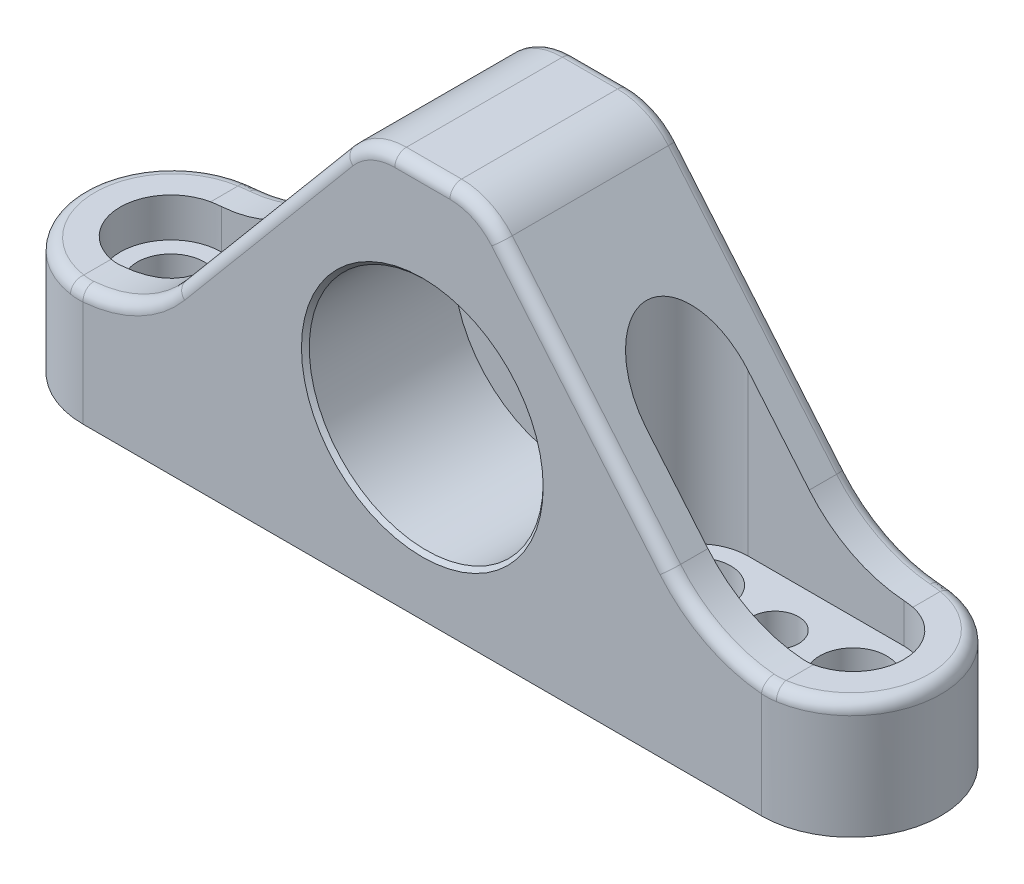
from build123d import *

# Parameters (mm, degrees)
BOSS_EXTRUDE1_DEPTH = 23
SKETCH2_OUTSIDE_W   = 271.2
SKETCH2_OUTSIDE_H   = 97.2
CUT_EXTRUDE1_DEPTH  = 151.429385427
FILLET1_R           = 35
FILLET2_R           = 17
CUT_EXTRUDE2_START  = 20
CUT_EXTRUDE2_DEPTH  = 131.429385516
SKETCH4_R           = 8.6
SKETCH4_R_2         = 6
CUT_EXTRUDE3_DEPTH  = 138.945641564
SKETCH5_R           = 30
CUT_EXTRUDE4_DEPTH  = 38
SKETCH6_R           = 4.5
SKETCH6_R_2         = 3.4
CUT_EXTRUDE5_DEPTH  = 156.614909412
CHAMFER1_SIZE       = 1
FILLET3_R           = 3


with BuildPart() as part:
    # Sketch1 → Boss-Extrude1 (new, symmetric)
    with BuildSketch(Plane.XY):
        Polygon((110, 0), (-110, 0), (-110, 30), (-73.736974182, 30), (-15, 100), (15, 100), (73.736974182, 30), (110, 30), align=None)
    extrude(amount=BOSS_EXTRUDE1_DEPTH, both=True)

    # Sketch2 outside → Cut-Extrude1 (cut, through all)
    with BuildSketch(Plane(origin=(0, 0, 0), x_dir=(1, 0, 0), z_dir=(0, 1, 0))):
        Rectangle(SKETCH2_OUTSIDE_W, SKETCH2_OUTSIDE_H)
        with BuildLine():
            Line((87, -23), (-87, -23))
            ThreePointArc((-87, -23), (-110, 0), (-87, 23))
            Line((-87, 23), (87, 23))
            ThreePointArc((87, 23), (110, 0), (87, -23))
        make_face(mode=Mode.SUBTRACT)
    extrude(amount=CUT_EXTRUDE1_DEPTH, mode=Mode.SUBTRACT)

    # Fillet1
    fillet1_edges = [part.edges().sort_by_distance(p)[0] for p in [
        (73.736974182, 30, 0),
        (-73.736974182, 30, 0),
    ]]
    fillet(fillet1_edges, radius=FILLET1_R)

    # Fillet2
    fillet2_edges = [part.edges().sort_by_distance(p)[0] for p in [
        (-15, 100, 0),
        (15, 100, 0),
    ]]
    fillet(fillet2_edges, radius=FILLET2_R)

    # Sketch3 → Cut-Extrude2 (cut, through all)
    with BuildSketch(Plane(origin=(0, 0, 0), x_dir=(1, 0, 0), z_dir=(0, 1, 0)).offset(CUT_EXTRUDE2_START)):
        with BuildLine():
            Line((-87.5, 13), (-47.5, 13))
            ThreePointArc((-47.5, 13), (-34.5, 0), (-47.5, -13))
            Line((-47.5, -13), (-87.5, -13))
            ThreePointArc((-87.5, -13), (-100.5, 0), (-87.5, 13))
        make_face()
        with BuildLine():
            Line((87.5, -13), (47.5, -13))
            ThreePointArc((47.5, -13), (34.5, 0), (47.5, 13))
            Line((47.5, 13), (87.5, 13))
            ThreePointArc((87.5, 13), (100.5, 0), (87.5, -13))
        make_face()
    extrude(amount=CUT_EXTRUDE2_DEPTH, mode=Mode.SUBTRACT)

    # Sketch4 → Cut-Extrude3 (cut, through all)
    with BuildSketch(Plane(origin=(0, 20, 0), x_dir=(1, 0, 0), z_dir=(0, 1, 0))):
        with Locations(Location((-87.5, 0, 0), (0, 0, 270))):
            Circle(SKETCH4_R)
        with Locations(Location((-47.5, 0, 0), (0, 0, 270))):
            Circle(SKETCH4_R)
        with Locations(Location((47.5, 0, 0), (0, 0, 270))):
            Circle(SKETCH4_R)
        with Locations(Location((87.5, 0, 0), (0, 0, 270))):
            Circle(SKETCH4_R)
        with Locations(Location((67.5, 0, 0), (0, 0, 270))):
            Circle(SKETCH4_R_2)
        with Locations(Location((-67.5, 0, 0), (0, 0, 270))):
            Circle(SKETCH4_R_2)
    extrude(amount=-CUT_EXTRUDE3_DEPTH, mode=Mode.SUBTRACT)

    # Sketch5 → Cut-Extrude4 (cut)
    with BuildSketch(Plane.XY.offset(23)):
        with Locations((0, 45)):
            Circle(SKETCH5_R)
    extrude(amount=-CUT_EXTRUDE4_DEPTH, mode=Mode.SUBTRACT)

    # Sketch6 → Cut-Extrude5 (cut, through all)
    with BuildSketch(Plane(origin=(0, 0, -23), x_dir=(-1, 0, 0), z_dir=(0, 0, -1))):
        with Locations((20, 45)):
            Circle(SKETCH6_R)
        with Locations((-20, 45)):
            Circle(SKETCH6_R)
        with Locations((0, 45)):
            Circle(SKETCH6_R_2)
    extrude(amount=-CUT_EXTRUDE5_DEPTH, mode=Mode.SUBTRACT)

    # Chamfer1
    chamfer1_edges = [part.edges().sort_by_distance(p)[0] for p in [
        (-30, 45, 23),
    ]]
    chamfer(chamfer1_edges, length=CHAMFER1_SIZE)

    # Fillet3
    fillet3_edges = [part.edges().sort_by_distance(p)[0] for p in [
        (41.670856027, 68.214911513, -23),
        (41.670856027, 68.214911513, 23),
        (110, 30, 0),
        (-110, 30, 0),
        (73.893294765, 33.95631081, -23),
        (88.530811729, 30.033323245, -22.949000314),
        (88.530811729, 30.033323245, 22.949000314),
        (73.893294765, 33.95631081, 23),
        (-88.530811729, 30.033323245, -22.949000314),
        (-73.893294765, 33.95631081, -23),
        (-73.893294765, 33.95631081, 23),
        (-88.530811729, 30.033323245, 22.949000314),
        (0, 100, -23),
        (0, 100, 23),
        (-41.670856027, 68.214911513, -23),
        (-14.257280261, 98.40723238, -23),
        (14.257280261, 98.40723238, -23),
        (-41.670856027, 68.214911513, 23),
        (-14.257280261, 98.40723238, 23),
        (14.257280261, 98.40723238, 23),
    ]]
    fillet(fillet3_edges, radius=FILLET3_R)


solid = part.part
